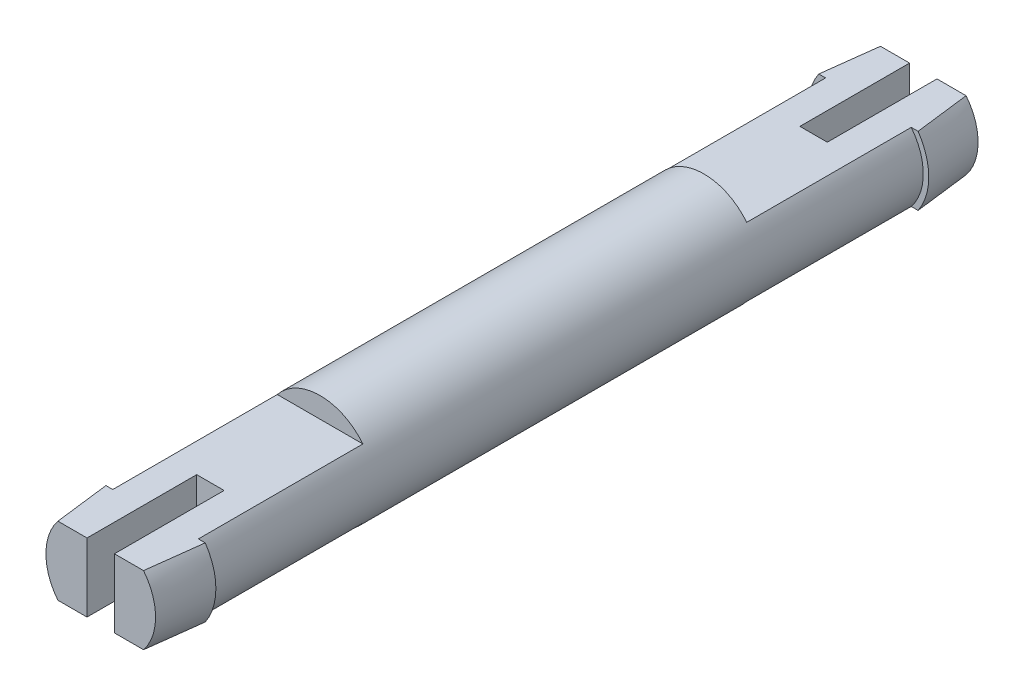
from build123d import *

# Parameters (mm, degrees)
SKETCH_1_R          = 2
EXTRUDE_1_DEPTH     = 30
SKETCH_3_W          = 4.2
SKETCH_3_H          = 1
CUT_EXTRUDE_1_DEPTH = 8
CUT_EXTRUDE_2_REACH = 32.256
SKETCH_4_W          = 1
SKETCH_4_H          = 4
SKETCH_6_W          = 4.2
SKETCH_6_H          = 1
CUT_EXTRUDE_3_DEPTH = 8
SKETCH_7_W          = 1
SKETCH_7_H          = 4
CUT_EXTRUDE_4_DEPTH = 31.255619313


with BuildPart() as part:
    # 草图1 → 凸台-拉伸1 (new body)
    with BuildSketch(Plane.XY):
        Circle(SKETCH_1_R)
    extrude(amount=-EXTRUDE_1_DEPTH)

    # 草图2 → 旋转1 (revolve)
    with BuildSketch(Plane(origin=(0, 0, 0), x_dir=(1, 0, 0), z_dir=(0, 1, 0))):
        Polygon((0, 0), (0, 2), (2.2, 2), (2, 0), align=None)
    revolve(axis=Axis((0, 0, 0), (0, 0, -1)))

    # 草图3 → 切除-拉伸1 (cut)
    with BuildSketch(Plane.XY):
        with Locations((0, 1.75)):
            Rectangle(SKETCH_3_W, SKETCH_3_H)
        with Locations((0, -1.75)):
            Rectangle(SKETCH_3_W, SKETCH_3_H)
    extrude(amount=-CUT_EXTRUDE_1_DEPTH, mode=Mode.SUBTRACT)

    # 草图4 → 切除-拉伸2 (cut, up to next)
    with BuildSketch(Plane.XZ.offset(1.25), mode=Mode.PRIVATE) as cut_extrude_2_sk1:
        with Locations((0, -2)):
            Rectangle(SKETCH_4_W, SKETCH_4_H)
    cut_extrude_2_tool1 = extrude(cut_extrude_2_sk1.sketch, amount=-CUT_EXTRUDE_2_REACH, mode=Mode.PRIVATE) & part.part
    add(cut_extrude_2_tool1.solids().sort_by_distance((0, -1.25, -2))[0], mode=Mode.SUBTRACT)

    # 草图5 → 旋转2 (revolve)
    with BuildSketch(Plane(origin=(0, 0, 0), x_dir=(1, 0, 0), z_dir=(0, 1, 0))):
        Polygon((0, 30), (0, 28), (2.2, 28), (2, 30), align=None)
    revolve(axis=Axis((0, 0, -58.137689197), (0, 0, -1)))

    # 草图6 → 切除-拉伸3 (cut)
    with BuildSketch(Plane(origin=(0, 0, -30), x_dir=(-1, 0, 0), z_dir=(0, 0, -1))):
        with Locations((0, 1.75)):
            Rectangle(SKETCH_6_W, SKETCH_6_H)
        with Locations((0, -1.75)):
            Rectangle(SKETCH_6_W, SKETCH_6_H)
    extrude(amount=-CUT_EXTRUDE_3_DEPTH, mode=Mode.SUBTRACT)

    # 草图7 → 切除-拉伸4 (cut, through all)
    with BuildSketch(Plane(origin=(0, 1.25, 0), x_dir=(1, 0, 0), z_dir=(0, 1, 0))):
        with Locations((0, 28)):
            Rectangle(SKETCH_7_W, SKETCH_7_H)
    extrude(amount=-CUT_EXTRUDE_4_DEPTH, mode=Mode.SUBTRACT)


solid = part.part
